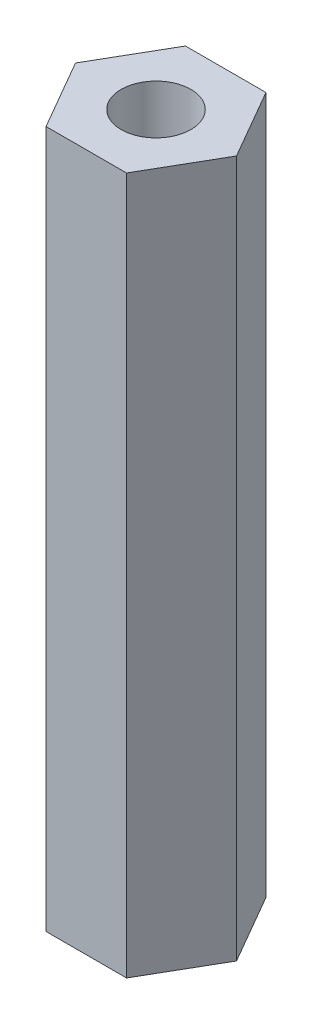
from build123d import *

# Parameters (mm, degrees)
SKETCH_1_R      = 1
EXTRUDE_1_DEPTH = 10


with BuildPart() as part:
    # 草图1 → 凸台-拉伸1 (new, symmetric)
    with BuildSketch(Plane(origin=(0, 0, 0), x_dir=(1, 0, 0), z_dir=(0, 1, 0))):
        Polygon((2.309401077, 0), (1.154700538, 2), (-1.154700538, 2), (-2.309401077, 0), (-1.154700538, -2), (1.154700538, -2), align=None)
        with Locations(Location((0, 0, 0), (0, 0, 270))):
            Circle(SKETCH_1_R, mode=Mode.SUBTRACT)
    extrude(amount=EXTRUDE_1_DEPTH, both=True)


solid = part.part
